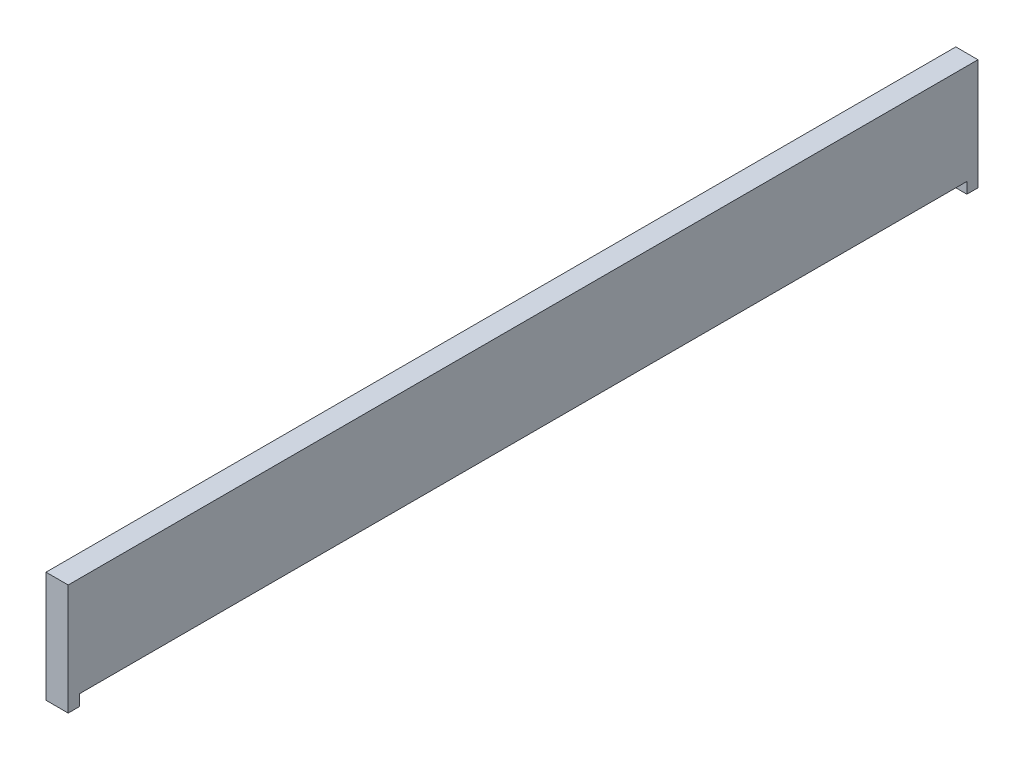
from build123d import *

# Parameters (mm, degrees)
EXTRUDE_1_DEPTH = 820
SKETCH_3_W      = 10
SKETCH_3_H      = 10
EXTRUDE_2_DEPTH = 10


with BuildPart() as part:
    # Эскиз1 → Бобышка-Вытянуть1 (new body)
    with BuildSketch(Plane.XY):
        Polygon((0, 0), (0, 100), (20, 100), (20, 10), (10, 10), (10, 0), align=None)
    extrude(amount=EXTRUDE_1_DEPTH)

    # Эскиз3 → Бобышка-Вытянуть2 (add)
    with BuildSketch(Plane(origin=(10, 0, 0), x_dir=(0, 0, -1), z_dir=(1, 0, 0))):
        with Locations((-815, 5)):
            Rectangle(SKETCH_3_W, SKETCH_3_H)
        with Locations((-5, 5)):
            Rectangle(SKETCH_3_W, SKETCH_3_H)
    extrude(amount=EXTRUDE_2_DEPTH)


solid = part.part
